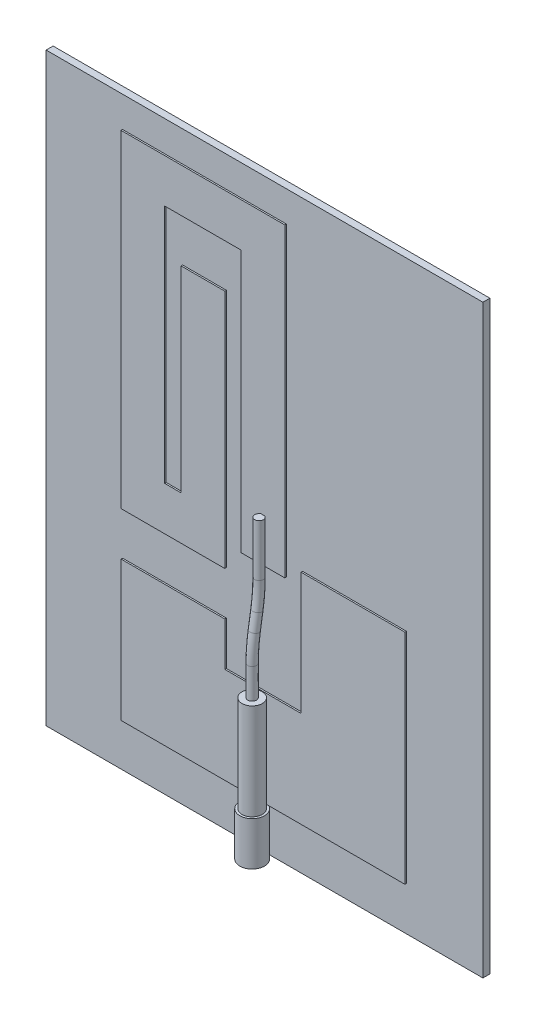
from build123d import *

# Parameters (mm, degrees)
SKETCH1_W           = 20
SKETCH1_H           = 26.8
BOSS_EXTRUDE1_DEPTH = 0.17
BOSS_EXTRUDE2_START = -0.17
SKETCH1_2_W         = 20
SKETCH1_2_H         = 26.8
BOSS_EXTRUDE2_DEPTH = 0.15
BOSS_EXTRUDE3_DEPTH = 0.07
SKETCH3_R           = 0.565
BOSS_EXTRUDE8_DEPTH = 2
SKETCH4_R           = 0.465
BOSS_EXTRUDE9_DEPTH = 4.4
SWEEP4_PROFILE_R    = 0.2


with BuildPart() as part:
    # Sketch1 → Boss-Extrude1 (new body)
    with BuildSketch(Plane.XY):
        Rectangle(SKETCH1_W, SKETCH1_H)
    extrude(amount=-BOSS_EXTRUDE1_DEPTH)

    # Sketch1<2> → Boss-Extrude2 (add)
    with BuildSketch(Plane.XY.offset(BOSS_EXTRUDE2_START)):
        Rectangle(SKETCH1_2_W, SKETCH1_2_H)
    extrude(amount=-BOSS_EXTRUDE2_DEPTH)

    # Sketch2 → Boss-Extrude3 (add)
    with BuildSketch(Plane.XY):
        Polygon((1, -2), (1, 12), (-6.5, 12), (-6.5, -3), (-1.75, -3), (-1.75, 8), (-3.75, 8), (-3.75, -1), (-4.5, -1), (-4.5, 10), (-1, 10), (-1, -2), align=None)
        Polygon((-6.5, -5), (-1.75, -5), (-1.75, -7), (1.75, -7), (1.75, -1.4), (6.5, -1.4), (6.5, -11.4), (-6.5, -11.4), align=None)
    extrude(amount=BOSS_EXTRUDE3_DEPTH)


with BuildPart() as body_2:
    # Sketch3 → Boss-Extrude8 (new body)
    with BuildSketch(Plane.XZ.offset(13.4)):
        with Locations((0, 0.565)):
            Circle(SKETCH3_R)
    extrude(amount=-BOSS_EXTRUDE8_DEPTH)

    # Sketch4 → Boss-Extrude9 (add)
    with BuildSketch(Plane(origin=(0, -11.4, 0), x_dir=(1, 0, 0), z_dir=(0, 1, 0))):
        with Locations(Location((0, -0.565, 0), (0, 0, 180))):
            Circle(SKETCH4_R)
    extrude(amount=BOSS_EXTRUDE9_DEPTH)


with BuildPart() as body_3:
    # Sweep4: sweep along a path in Sketch5
    with BuildLine(Plane(origin=(0, 0, 0), x_dir=(0, 0, -1), z_dir=(1, 0, 0))) as sweep4_path:
        Line((-0.565, -7), (-0.565, -5.626140736))
        ThreePointArc((-0.565, -5.626140736), (-0.540608741, -5.001909045), (-0.467583699, -4.381483803))
        Line((-0.467583699, -4.381483803), (-0.347416301, -3.618516197))
        ThreePointArc((-0.347416301, -3.618516197), (-0.274391259, -2.998090955), (-0.25, -2.373859264))
        Line((-0.25, -2.373859264), (-0.25, 0))
    # Sweep4 profile (on start of the path) → Sweep4 (sweep)
    with BuildSketch(Plane(origin=(0, -7, 0.565), x_dir=(0, 0, 1), z_dir=(0, 1, 0))):
        Circle(SWEEP4_PROFILE_R)
    sweep(path=sweep4_path.line)


solid = Compound([part.part, body_2.part, body_3.part])
